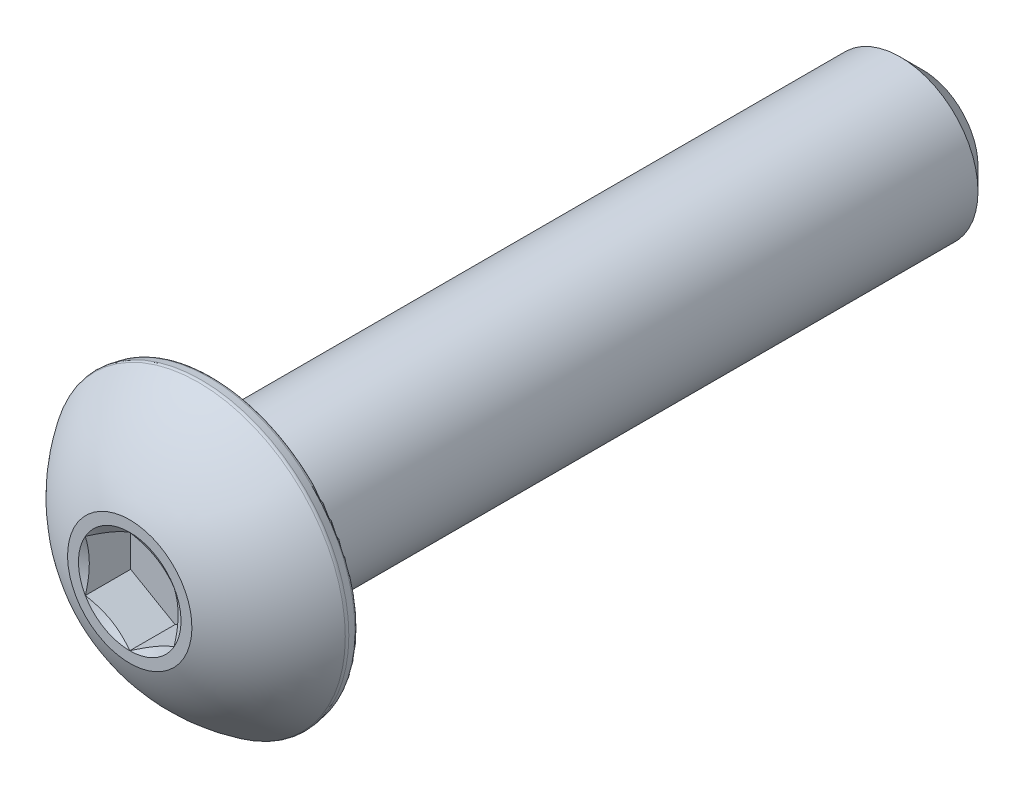
from build123d import *

# Parameters (mm, degrees)
CUT_EXTRUDE1_DEPTH = 1.21539
FILLET1_R          = 0.11049


with BuildPart() as part:
    # Sketch3 → Revolve1 (revolve)
    with BuildSketch(Plane(origin=(0, 0, 0), x_dir=(0, 0, -1), z_dir=(1, 0, 0)), mode=Mode.PRIVATE) as revolve1_sk:
        with BuildLine():
            Line((-10.6299, 0), (-10.6299, 1.666875))
            ThreePointArc((-10.6299, 1.666875), (-9.877170588, 2.967189774), (-8.75157, 3.9624))
            Line((-8.75157, 3.9624), (-8.4201, 3.903952896))
            Line((-8.4201, 3.903952896), (-8.4201, 2.0828))
            Line((-8.4201, 2.0828), (10.0345875, 2.0828))
            Line((10.0345875, 2.0828), (10.6299, 1.4874875))
            Line((10.6299, 1.4874875), (10.6299, 0))
            Line((10.6299, 0), (-10.6299, 0))
        make_face()
    revolve(revolve1_sk.sketch.rotate(Axis((0, 0, 10.6299), (0, 0, -1)), 90), axis=Axis((0, 0, 10.6299), (0, 0, -1)))

    # Sketch4 → Cut-Extrude1 (cut)
    with BuildSketch(Plane.XY.offset(10.6299)):
        Polygon((-1.190625, -0.687407664), (0, -1.374815329), (1.190625, -0.687407664), (1.190625, 0.687407664), (0, 1.374815329), (-1.190625, 0.687407664), align=None)
    extrude(amount=-CUT_EXTRUDE1_DEPTH, mode=Mode.SUBTRACT)

    # Cut-Extrude2 cone 1 section (through the dimple's axis) → Cut-Extrude2 (revolve, cut)
    with BuildSketch(Plane(origin=(0, 0, 10.6299), x_dir=(0, -1, 0), z_dir=(1, 0, 0))):
        Polygon((0, 0), (1.374815329, 0), (0, 0.79375), align=None)
    revolve(axis=Axis((0, 0, 10.6299), (0, 0, -1)), mode=Mode.SUBTRACT)

    # Fillet1
    fillet1_edges = [part.edges().sort_by_distance(p)[0] for p in [
        (-3.903952896, 0, 8.4201),
        (-3.9624, 0, 8.75157),
    ]]
    fillet(fillet1_edges, radius=FILLET1_R)


solid = part.part
